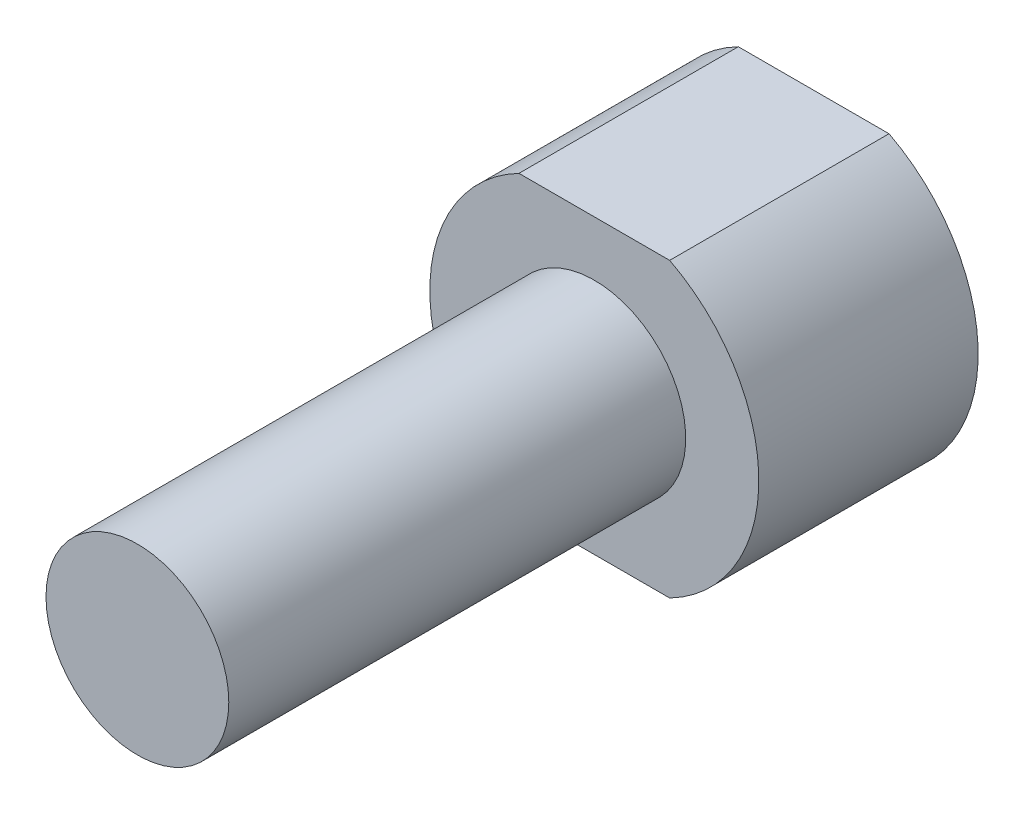
from build123d import *

# Parameters (mm, degrees)
BOSS_EXTRU_1_DEPTH = 12
ESQUISSE2_R        = 5
BOSS_EXTRU_2_DEPTH = 25


with BuildPart() as part:
    # Esquisse1 → Boss.-Extru.1 (new body)
    with BuildSketch(Plane.XY):
        with BuildLine():
            Line((-4.123105626, 8), (4.123105626, 8))
            ThreePointArc((4.123105626, 8), (9, 0), (4.123105626, -8))
            Line((4.123105626, -8), (-4.123105626, -8))
            ThreePointArc((-4.123105626, -8), (-9, 0), (-4.123105626, 8))
        make_face()
    extrude(amount=BOSS_EXTRU_1_DEPTH)

    # Esquisse2 → Boss.-Extru.2 (add)
    with BuildSketch(Plane.XY.offset(12)):
        with Locations(Location((0, 0, 0), (0, 0, 180))):
            Circle(ESQUISSE2_R)
    extrude(amount=BOSS_EXTRU_2_DEPTH)


solid = part.part
